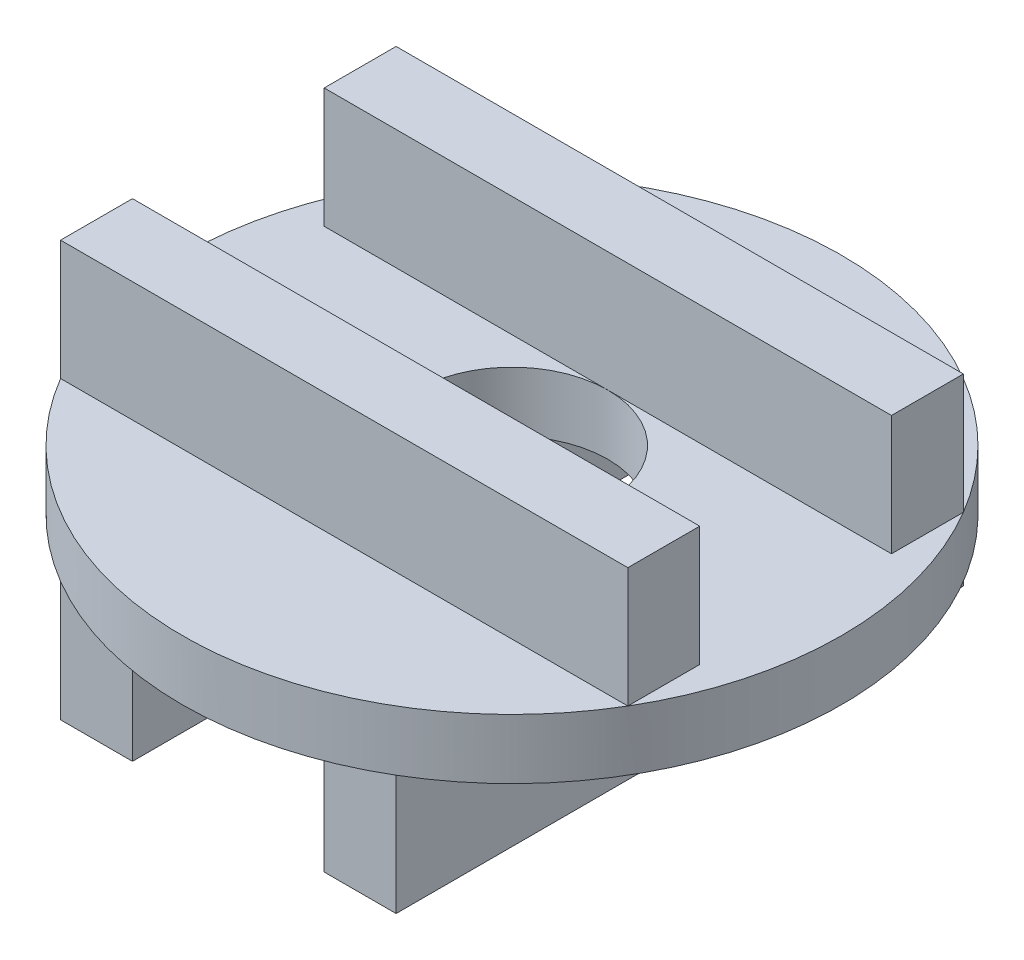
from build123d import *

# Parameters (mm, degrees)
SKETCH1_W             = 94.678403028
SKETCH1_H             = 12
BOSS_EXTRUDE1_DEPTH   = 30
BOSS_EXTRUDE1_2_DEPTH = 30
SKETCH1_3_W           = 12
SKETCH1_3_H           = 94.678403028
BOSS_EXTRUDE2_DEPTH   = 20
BOSS_EXTRUDE4_DEPTH   = 10


with BuildPart() as part:
    # Sketch1 → Boss-Extrude1 (new body)
    with BuildSketch(Plane(origin=(0, 0, 0), x_dir=(1, 0, 0), z_dir=(0, 1, 0))):
        with Locations((0, 22)):
            Rectangle(SKETCH1_W, SKETCH1_H)
    extrude(amount=BOSS_EXTRUDE1_DEPTH)



with BuildPart() as body_2:
    # Sketch1 → Boss-Extrude1 2 (new body)
    with BuildSketch(Plane(origin=(0, 0, 0), x_dir=(1, 0, 0), z_dir=(0, 1, 0))):
        with Locations((0, -22)):
            Rectangle(SKETCH1_W, SKETCH1_H)
    extrude(amount=BOSS_EXTRUDE1_2_DEPTH)


with BuildPart() as part_1:
    add(part.part)

    add(body_2.part)  # Boss-Extrude2 merges body 2
    # Sketch1<3> → Boss-Extrude2 (add)
    with BuildSketch(Plane(origin=(0, 0, 0), x_dir=(1, 0, 0), z_dir=(0, 1, 0))):
        with Locations((22, 0)):
            Rectangle(SKETCH1_3_W, SKETCH1_3_H)
        with Locations((-22, 0)):
            Rectangle(SKETCH1_3_W, SKETCH1_3_H)
    extrude(amount=-BOSS_EXTRUDE2_DEPTH)

    # Sketch1<4> → Boss-Extrude4 (add)
    with BuildSketch(Plane(origin=(0, 0, 0), x_dir=(1, 0, 0), z_dir=(0, 1, 0))):
        with BuildLine():
            ThreePointArc((47.339201514, 28), (0, 55), (-47.339201514, 28))
            Line((-47.339201514, 28), (47.339201514, 28))
        make_face()
        with BuildLine():
            Line((47.339201514, 28), (47.339201514, 16))
            Line((47.339201514, 16), (0, 16))
            ThreePointArc((0, 16), (16, 2.7e-08), (5.5e-08, -16))
            Line((5.5e-08, -16), (47.339201514, -16))
            Line((47.339201514, -16), (47.339201514, -28))
            ThreePointArc((47.339201514, -28), (55, 0), (47.339201514, 28))
        make_face()
        with BuildLine():
            Line((-47.339201514, 16), (-47.339201514, 28))
            ThreePointArc((-47.339201514, 28), (-55, 0), (-47.339201514, -28))
            Line((-47.339201514, -28), (-47.339201514, -16))
            Line((-47.339201514, -16), (5.5e-08, -16))
            ThreePointArc((5.5e-08, -16), (-16, -2.7e-08), (0, 16))
            Line((0, 16), (-47.339201514, 16))
        make_face()
        with BuildLine():
            Line((47.339201514, -28), (-47.339201514, -28))
            ThreePointArc((-47.339201514, -28), (0, -55), (47.339201514, -28))
        make_face()
    extrude(amount=BOSS_EXTRUDE4_DEPTH)


solid = part_1.part
